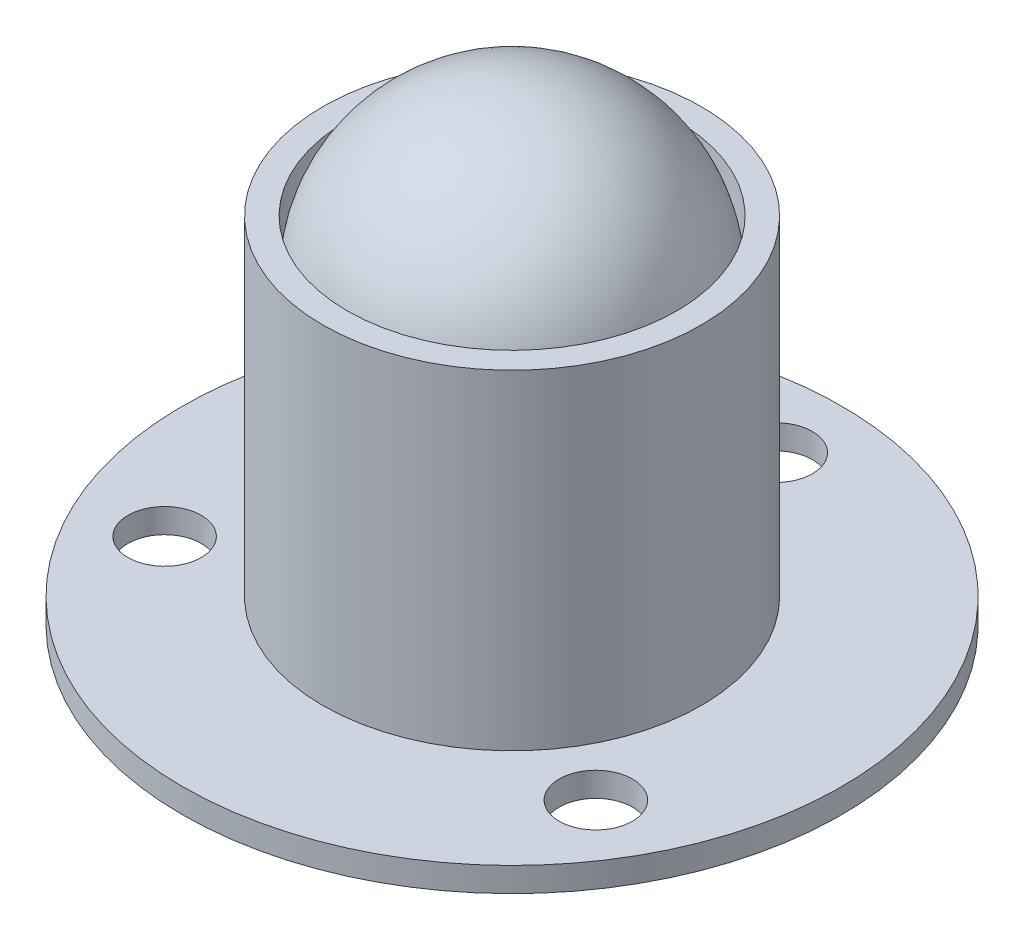
from build123d import *

# Parameters (mm, degrees)
SKETCH1_R           = 13.5
BOSS_EXTRUDE1_DEPTH = 1
SKETCH2_R           = 7.75
BOSS_EXTRUDE2_DEPTH = 13.5
SHELL1_T            = -1
SKETCH5_R           = 1.5
CUT_EXTRUDE1_DEPTH  = 13.5
CIRPATTERN1_COUNT   = 3


with BuildPart() as part:
    # Sketch1 → Boss-Extrude1 (new body)
    with BuildSketch(Plane(origin=(0, 0, 0), x_dir=(1, 0, 0), z_dir=(0, 1, 0))):
        with Locations(Location((0, 0, 0), (0, 0, 270))):
            Circle(SKETCH1_R)
    extrude(amount=BOSS_EXTRUDE1_DEPTH)

    # Sketch2 → Boss-Extrude2 (add)
    with BuildSketch(Plane(origin=(0, 1, 0), x_dir=(1, 0, 0), z_dir=(0, 1, 0))):
        with Locations(Location((0, 0, 0), (0, 0, 270))):
            Circle(SKETCH2_R)
    extrude(amount=BOSS_EXTRUDE2_DEPTH)

    # Shell1
    shell1_openings = [part.faces().sort_by_distance(p)[0] for p in [
        (0, 14.5, 0),
    ]]
    offset(amount=SHELL1_T, openings=shell1_openings, kind=Kind.INTERSECTION)

    # Sketch5 → Cut-Extrude1 (cut)
    with BuildSketch(Plane(origin=(0, 1, 0), x_dir=(1, 0, 0), z_dir=(0, 1, 0))):
        with Locations(Location((0.301226675, 10.5, 0), (0, 0, 270))):
            Circle(SKETCH5_R)
    cut_extrude1 = extrude(amount=-CUT_EXTRUDE1_DEPTH, mode=Mode.SUBTRACT)

    # CirPattern1: Cut-Extrude1 ×3 about axis
    cirpattern1_axis = Axis((0, 0, 0), (0, 1, 0))
    for i in range(1, CIRPATTERN1_COUNT):
        add(cut_extrude1.rotate(cirpattern1_axis, i * 360 / CIRPATTERN1_COUNT), mode=Mode.SUBTRACT)


with BuildPart() as body_2:
    # Sketch4 → Revolve3 (revolve)
    with BuildSketch(Plane(origin=(0, 12.25, 0), x_dir=(1, 0, 0), z_dir=(0, 1, 0))):
        with BuildLine():
            Line((0, 6.75), (0, -6.75))
            ThreePointArc((0, -6.75), (-6.75, 0), (0, 6.75))
        make_face()
    revolve(axis=Axis((0, 12.25, -6.75), (0, 0, 1)))


solid = Compound([part.part, body_2.part])
